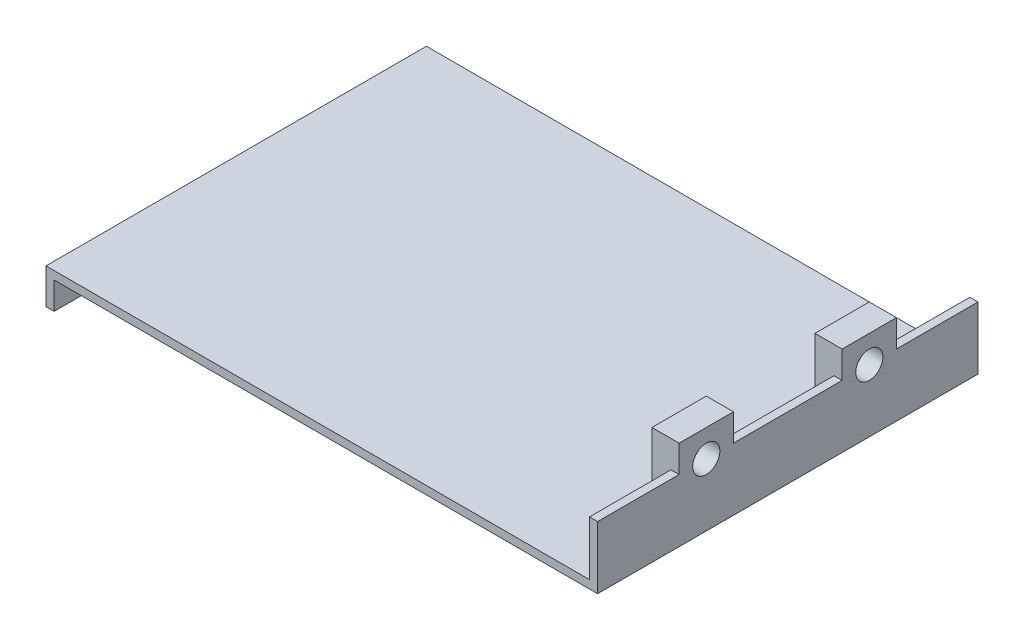
from build123d import *

# Parameters (mm, degrees)
SKETCH1_W           = 1.5
SKETCH1_H           = 70
BOSS_EXTRUDE1_DEPTH = 5
SKETCH1_3_W         = 101.5
SKETCH1_3_H         = 70
BOSS_EXTRUDE2_DEPTH = 1.5
BOSS_EXTRUDE3_START = 1.5
SKETCH1_4_W         = 1.5
SKETCH1_4_H         = 70
BOSS_EXTRUDE3_DEPTH = 10
SKETCH2_W           = 10
SKETCH2_H           = 5
BOSS_EXTRUDE4_DEPTH = 1.5
BOSS_EXTRUDE5_START = -1.5
SKETCH2_4_W         = 10
SKETCH2_4_H         = 5
BOSS_EXTRUDE5_DEPTH = 3.5
SKETCH4_R           = 4.95
SKETCH4_R_2         = 2.5
CUT_EXTRUDE1_DEPTH  = 1.5
SKETCH4_2_R         = 2.5
CUT_EXTRUDE2_DEPTH  = 106.785569976


with BuildPart() as part:
    # Sketch1 → Boss-Extrude1 (new body)
    with BuildSketch(Plane(origin=(0, 0, 0), x_dir=(1, 0, 0), z_dir=(0, 1, 0))):
        with Locations((-63.901879758, 5.076012966)):
            Rectangle(SKETCH1_W, SKETCH1_H)
    extrude(amount=-BOSS_EXTRUDE1_DEPTH)

    # Sketch1<3> → Boss-Extrude2 (add)
    with BuildSketch(Plane(origin=(0, 0, 0), x_dir=(1, 0, 0), z_dir=(0, 1, 0))):
        with Locations((-13.901879758, 5.076012966)):
            Rectangle(SKETCH1_3_W, SKETCH1_3_H)
    extrude(amount=BOSS_EXTRUDE2_DEPTH)

    # Sketch1<4> → Boss-Extrude3 (add)
    with BuildSketch(Plane(origin=(0, 0, 0), x_dir=(1, 0, 0), z_dir=(0, 1, 0)).offset(BOSS_EXTRUDE3_START)):
        with Locations((36.098120242, 5.076012966)):
            Rectangle(SKETCH1_4_W, SKETCH1_4_H)
    extrude(amount=BOSS_EXTRUDE3_DEPTH)

    # Sketch2 → Boss-Extrude4 (add)
    with BuildSketch(Plane(origin=(36.848120242, 0, 0), x_dir=(0, 0, -1), z_dir=(1, 0, 0))):
        with Locations((-9.923987034, 14)):
            Rectangle(SKETCH2_W, SKETCH2_H)
        with Locations((20.076012966, 14)):
            Rectangle(SKETCH2_W, SKETCH2_H)
    extrude(amount=-BOSS_EXTRUDE4_DEPTH)

    # Sketch2<4> → Boss-Extrude5 (add)
    with BuildSketch(Plane(origin=(36.848120242, 0, 0), x_dir=(0, 0, -1), z_dir=(1, 0, 0)).offset(BOSS_EXTRUDE5_START)):
        with Locations((-9.923987034, 14)):
            Rectangle(SKETCH2_4_W, SKETCH2_4_H)
        with Locations((-9.923987034, 9)):
            Rectangle(SKETCH2_4_W, SKETCH2_4_H)
        with Locations((20.076012966, 9)):
            Rectangle(SKETCH2_4_W, SKETCH2_4_H)
        with Locations((20.076012966, 14)):
            Rectangle(SKETCH2_4_W, SKETCH2_4_H)
        with Locations((-9.923987034, 4)):
            Rectangle(SKETCH2_4_W, SKETCH2_4_H)
        with Locations((20.076012966, 4)):
            Rectangle(SKETCH2_4_W, SKETCH2_4_H)
    extrude(amount=-BOSS_EXTRUDE5_DEPTH)

    # Sketch4 → Cut-Extrude1 (cut)
    # profile 1 of 2: a face of its own
    with BuildSketch(Plane.ZY.offset(-31.848120242)):
        with Locations((-20.076012966, 11.5)):
            Circle(SKETCH4_R)
        with Locations((-20.076012966, 11.5)):
            Circle(SKETCH4_R_2, mode=Mode.SUBTRACT)
    # profile 2 of 2: a face of its own
    with BuildSketch(Plane.ZY.offset(-31.848120242)):
        with Locations((9.923987034, 11.5)):
            Circle(SKETCH4_R)
        with Locations((9.923987034, 11.5)):
            Circle(SKETCH4_R_2, mode=Mode.SUBTRACT)
    extrude(amount=-CUT_EXTRUDE1_DEPTH, mode=Mode.SUBTRACT)

    # Sketch4<2> → Cut-Extrude2 (cut, through all)
    with BuildSketch(Plane.ZY.offset(-31.848120242)):
        with Locations((-20.076012966, 11.5)):
            Circle(SKETCH4_2_R)
        with Locations((9.923987034, 11.5)):
            Circle(SKETCH4_2_R)
    extrude(amount=-CUT_EXTRUDE2_DEPTH, mode=Mode.SUBTRACT)


solid = part.part
